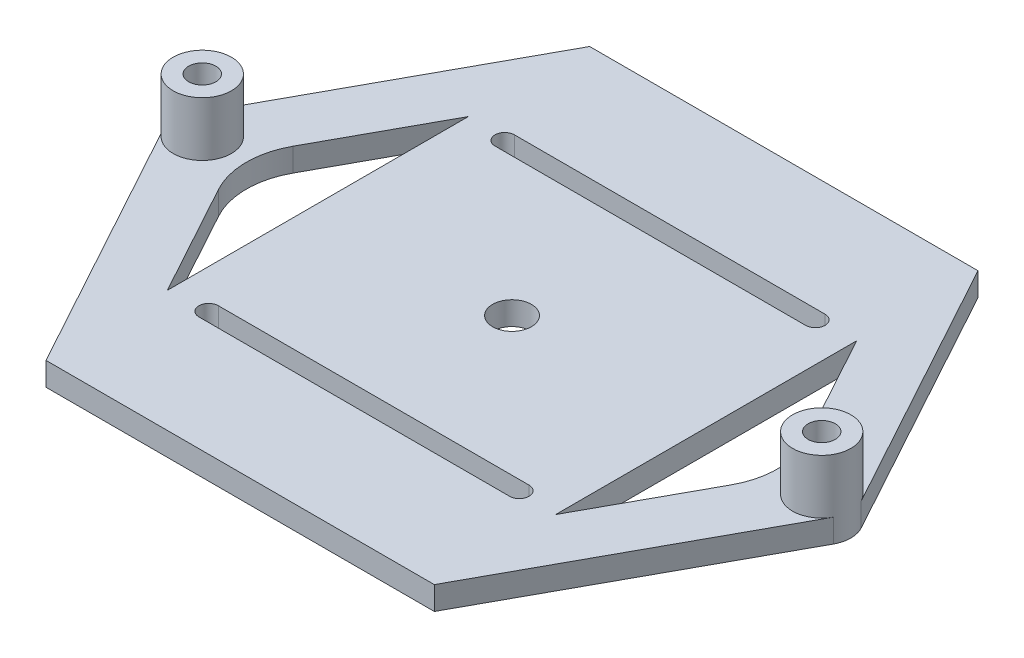
from build123d import *

# Parameters (mm, degrees)
SKETCH1_R             = 3.75
SKETCH1_R_2           = 1.75
BOSS_EXTRUDE1_DEPTH   = 10
BOSS_EXTRUDE1_2_DEPTH = 10
BOSS_EXTRUDE2_START   = -3
BOSS_EXTRUDE2_DEPTH   = 3
SKETCH3_R             = 2.5
CUT_EXTRUDE1_DEPTH    = 57.367102098
CUT_EXTRUDE2_DEPTH    = 57.367102098


with BuildPart() as part:
    # Sketch1 → Boss-Extrude1 (new body)
    with BuildSketch(Plane.XZ.offset(100.2)):
        with Locations(Location((-39.876255843, 0, 0), (0, 0, 270))):
            Circle(SKETCH1_R)
        with Locations(Location((-39.876255843, 0, 0), (0, 0, 270))):
            Circle(SKETCH1_R_2, mode=Mode.SUBTRACT)
    extrude(amount=BOSS_EXTRUDE1_DEPTH)



with BuildPart() as body_2:
    # Sketch1 → Boss-Extrude1 2 (new body)
    with BuildSketch(Plane.XZ.offset(100.2)):
        with Locations(Location((39.876255843, 0, 0), (0, 0, 90))):
            Circle(SKETCH1_R)
        with Locations(Location((39.876255843, 0, 0), (0, 0, 90))):
            Circle(SKETCH1_R_2, mode=Mode.SUBTRACT)
    extrude(amount=BOSS_EXTRUDE1_2_DEPTH)


with BuildPart() as part_1:
    add(part.part)

    add(body_2.part)  # Boss-Extrude2 merges body 2
    # Sketch2 → Boss-Extrude2 (add)
    with BuildSketch(Plane.XZ.offset(110.2).offset(BOSS_EXTRUDE2_START)):
        with BuildLine():
            Line((25, 35), (-25, 35))
            Line((-25, 35), (-43.165990296, 1.800040897))
            ThreePointArc((-43.165990296, 1.800040897), (-38.94727904, 3.633111903), (-36.126255843, 0))
            ThreePointArc((-36.126255843, 0), (-38.94727904, -3.633111903), (-43.165990296, -1.800040897))
            Line((-43.165990296, -1.800040897), (-25, -35))
            Line((-25, -35), (25, -35))
            Line((25, -35), (43.165990296, -1.800040897))
            ThreePointArc((43.165990296, -1.800040897), (36.126255843, 0), (43.165990296, 1.800040897))
            Line((43.165990296, 1.800040897), (25, 35))
        make_face()
        with BuildLine():
            Line((-25, 19.375354996), (-25, -19.375354996))
            Line((-25, -19.375354996), (-32.975123568, -4.800109057))
            ThreePointArc((-32.975123568, -4.800109057), (-34.20249836, 0), (-32.975123568, 4.800109057))
            Line((-32.975123568, 4.800109057), (-25, 19.375354996))
        make_face(mode=Mode.SUBTRACT)
        with BuildLine():
            Line((32.975123568, -4.800109057), (25, -19.375354996))
            Line((25, -19.375354996), (25, 19.375354996))
            Line((25, 19.375354996), (32.975123568, 4.800109057))
            ThreePointArc((32.975123568, 4.800109057), (34.20249836, 0), (32.975123568, -4.800109057))
        make_face(mode=Mode.SUBTRACT)
    extrude(amount=BOSS_EXTRUDE2_DEPTH)

    # Sketch3 → Cut-Extrude1 (cut, through all)
    with BuildSketch(Plane(origin=(0, -107.2, 0), x_dir=(1, 0, 0), z_dir=(0, 1, 0))):
        with Locations(Location((0, 0, 0), (0, 0, 270))):
            Circle(SKETCH3_R)
    extrude(amount=-CUT_EXTRUDE1_DEPTH, mode=Mode.SUBTRACT)

    # Sketch4 → Cut-Extrude2 (cut, through all)
    with BuildSketch(Plane(origin=(0, -107.2, 0), x_dir=(1, 0, 0), z_dir=(0, 1, 0))):
        with BuildLine():
            Line((20, -17.807929785), (-20, -17.807929785))
            ThreePointArc((-20, -17.807929785), (-21.25, -19.057929785), (-20, -20.307929785))
            Line((-20, -20.307929785), (20, -20.307929785))
            ThreePointArc((20, -20.307929785), (21.25, -19.057929785), (20, -17.807929785))
        make_face()
        with BuildLine():
            Line((20, 20.307929785), (-20, 20.307929785))
            ThreePointArc((-20, 20.307929785), (-21.25, 19.057929785), (-20, 17.807929785))
            Line((-20, 17.807929785), (20, 17.807929785))
            ThreePointArc((20, 17.807929785), (21.25, 19.057929785), (20, 20.307929785))
        make_face()
    extrude(amount=-CUT_EXTRUDE2_DEPTH, mode=Mode.SUBTRACT)


solid = part_1.part
